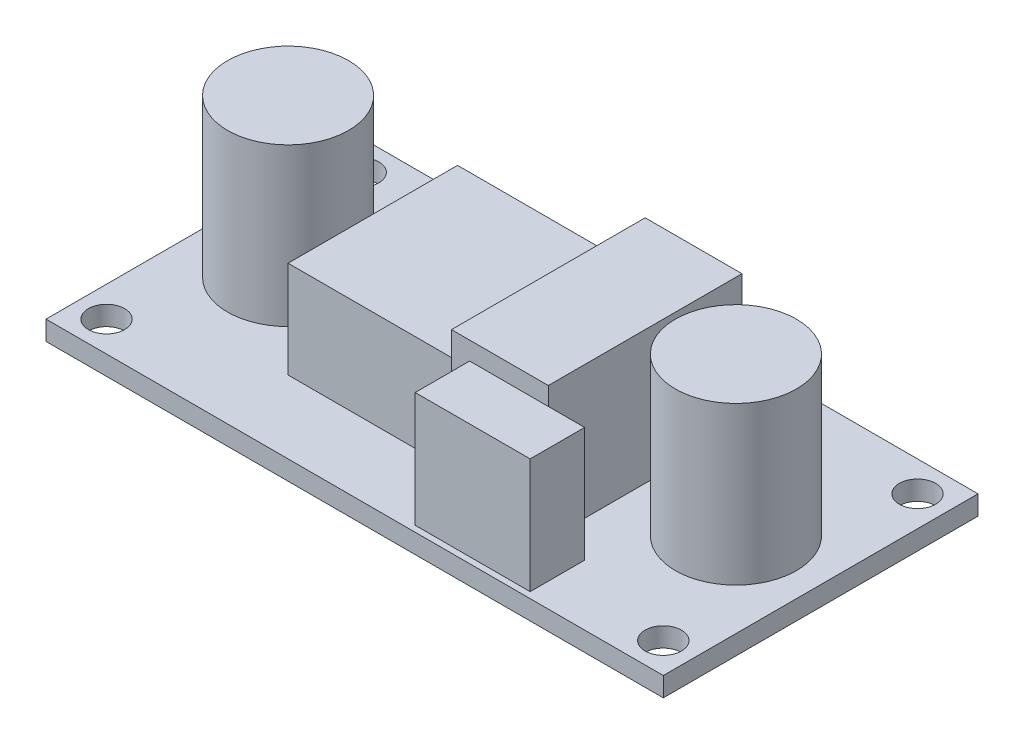
from build123d import *

# Parameters (mm, degrees)
SKETCH1_W               = 51
SKETCH1_H               = 26
PCB_DEPTH               = 1.6
MOUNT_HOLE_1_DEPTH      = 58.267442758
MOUNT_HOLE_1_DEPTH_BACK = 58.267442758
SKETCH2_R               = 1.5
MOUNT_HOLE_2_DEPTH      = 58.267442758
MOUNT_HOLE_2_DEPTH_BACK = 58.267442758
SKETCH3_R               = 1.5
MOUNT_HOLE_3_DEPTH      = 58.267442758
MOUNT_HOLE_3_DEPTH_BACK = 58.267442758
SKETCH4_R               = 1.5
MOUNT_HOLE_4_DEPTH      = 58.267442758
MOUNT_HOLE_4_DEPTH_BACK = 58.267442758
SKETCH5_R               = 1.5
INDUCTOR_START          = 1.6
SKETCH6_W               = 14
SKETCH6_H               = 14
INDUCTOR_DEPTH          = 8
CAP_IN_START            = 1.6
SKETCH7_R               = 5
CAP_IN_DEPTH            = 13
CAP_OUT_START           = 1.6
SKETCH8_R               = 5
CAP_OUT_DEPTH           = 13
HEATSINK_START          = 1.6
SKETCH9_W               = 8
SKETCH9_H               = 16
HEATSINK_DEPTH          = 11
TRIM_POT_START          = 1.6
SKETCH10_W              = 9.5
SKETCH10_H              = 4.5
TRIM_POT_DEPTH          = 9.5


with BuildPart() as part:
    # Sketch1 → PCB (new body)
    with BuildSketch(Plane(origin=(0, 0, 0), x_dir=(1, 0, 0), z_dir=(0, 1, 0))):
        with Locations((25.5, 13)):
            Rectangle(SKETCH1_W, SKETCH1_H)
    extrude(amount=PCB_DEPTH)

    # Sketch2 → Mount_hole_1 (cut, two sides: drawn at the far end of the back side and taken through both)
    with BuildSketch(Plane(origin=(0, 0, 0), x_dir=(1, 0, 0), z_dir=(0, 1, 0)).offset(-MOUNT_HOLE_1_DEPTH_BACK)):
        with Locations(Location((2.5, 2.5, 0), (0, 0, 270))):
            Circle(SKETCH2_R)
    extrude(amount=MOUNT_HOLE_1_DEPTH + MOUNT_HOLE_1_DEPTH_BACK, mode=Mode.SUBTRACT)

    # Sketch3 → Mount_hole_2 (cut, two sides: drawn at the far end of the back side and taken through both)
    with BuildSketch(Plane(origin=(0, 0, 0), x_dir=(1, 0, 0), z_dir=(0, 1, 0)).offset(-MOUNT_HOLE_2_DEPTH_BACK)):
        with Locations(Location((48.5, 2.5, 0), (0, 0, 270))):
            Circle(SKETCH3_R)
    extrude(amount=MOUNT_HOLE_2_DEPTH + MOUNT_HOLE_2_DEPTH_BACK, mode=Mode.SUBTRACT)

    # Sketch4 → Mount_hole_3 (cut, two sides: drawn at the far end of the back side and taken through both)
    with BuildSketch(Plane(origin=(0, 0, 0), x_dir=(1, 0, 0), z_dir=(0, 1, 0)).offset(-MOUNT_HOLE_3_DEPTH_BACK)):
        with Locations(Location((2.5, 23.5, 0), (0, 0, 270))):
            Circle(SKETCH4_R)
    extrude(amount=MOUNT_HOLE_3_DEPTH + MOUNT_HOLE_3_DEPTH_BACK, mode=Mode.SUBTRACT)

    # Sketch5 → Mount_hole_4 (cut, two sides: drawn at the far end of the back side and taken through both)
    with BuildSketch(Plane(origin=(0, 0, 0), x_dir=(1, 0, 0), z_dir=(0, 1, 0)).offset(-MOUNT_HOLE_4_DEPTH_BACK)):
        with Locations(Location((48.5, 23.5, 0), (0, 0, 270))):
            Circle(SKETCH5_R)
    extrude(amount=MOUNT_HOLE_4_DEPTH + MOUNT_HOLE_4_DEPTH_BACK, mode=Mode.SUBTRACT)

    # Sketch6 → Inductor (add)
    with BuildSketch(Plane(origin=(0, 0, 0), x_dir=(1, 0, 0), z_dir=(0, 1, 0)).offset(INDUCTOR_START)):
        with Locations((21, 13)):
            Rectangle(SKETCH6_W, SKETCH6_H)
    extrude(amount=INDUCTOR_DEPTH)

    # Sketch7 → Cap_in (add)
    with BuildSketch(Plane(origin=(0, 0, 0), x_dir=(1, 0, 0), z_dir=(0, 1, 0)).offset(CAP_IN_START)):
        with Locations(Location((7, 13, 0), (0, 0, 90))):
            Circle(SKETCH7_R)
    extrude(amount=CAP_IN_DEPTH)

    # Sketch8 → Cap_out (add)
    with BuildSketch(Plane(origin=(0, 0, 0), x_dir=(1, 0, 0), z_dir=(0, 1, 0)).offset(CAP_OUT_START)):
        with Locations(Location((44, 13, 0), (0, 0, 90))):
            Circle(SKETCH8_R)
    extrude(amount=CAP_OUT_DEPTH)

    # Sketch9 → Heatsink (add)
    with BuildSketch(Plane(origin=(0, 0, 0), x_dir=(1, 0, 0), z_dir=(0, 1, 0)).offset(HEATSINK_START)):
        with Locations((32.5, 13)):
            Rectangle(SKETCH9_W, SKETCH9_H)
    extrude(amount=HEATSINK_DEPTH)

    # Sketch10 → Trim_pot (add)
    with BuildSketch(Plane(origin=(0, 0, 0), x_dir=(1, 0, 0), z_dir=(0, 1, 0)).offset(TRIM_POT_START)):
        with Locations((34.75, 2.75)):
            Rectangle(SKETCH10_W, SKETCH10_H)
    extrude(amount=TRIM_POT_DEPTH)


solid = part.part
